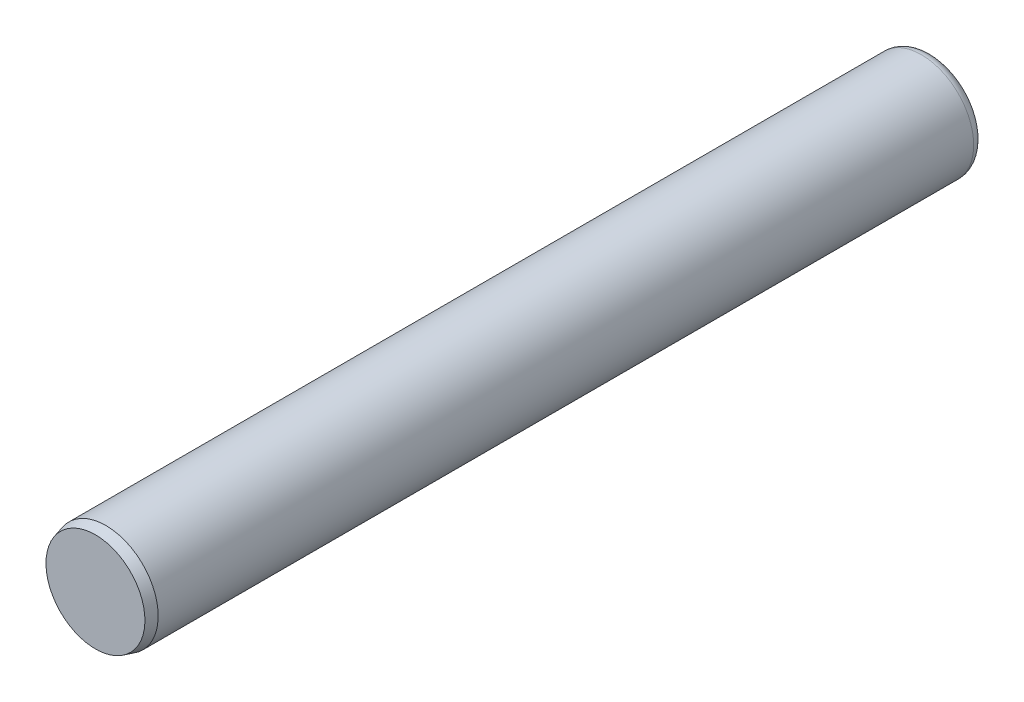
from build123d import *


with BuildPart() as part:
    # Sketch3 → Revolve1 (revolve)
    with BuildSketch(Plane(origin=(0, 0, 0), x_dir=(0, 0, -1), z_dir=(1, 0, 0))):
        with BuildLine():
            Line((-6.35, 0), (-6.35, 0.751213066))
            Line((-6.35, 0.751213066), (-6.19125, 0.79375))
            Line((-6.19125, 0.79375), (6.19125, 0.79375))
            ThreePointArc((6.19125, 0.79375), (6.303503202, 0.747253202), (6.35, 0.635))
            Line((6.35, 0.635), (6.35, 0))
            Line((6.35, 0), (-6.35, 0))
        make_face()
    revolve(axis=Axis((0, 0, -6.35), (0, 0, 1)))


solid = part.part
